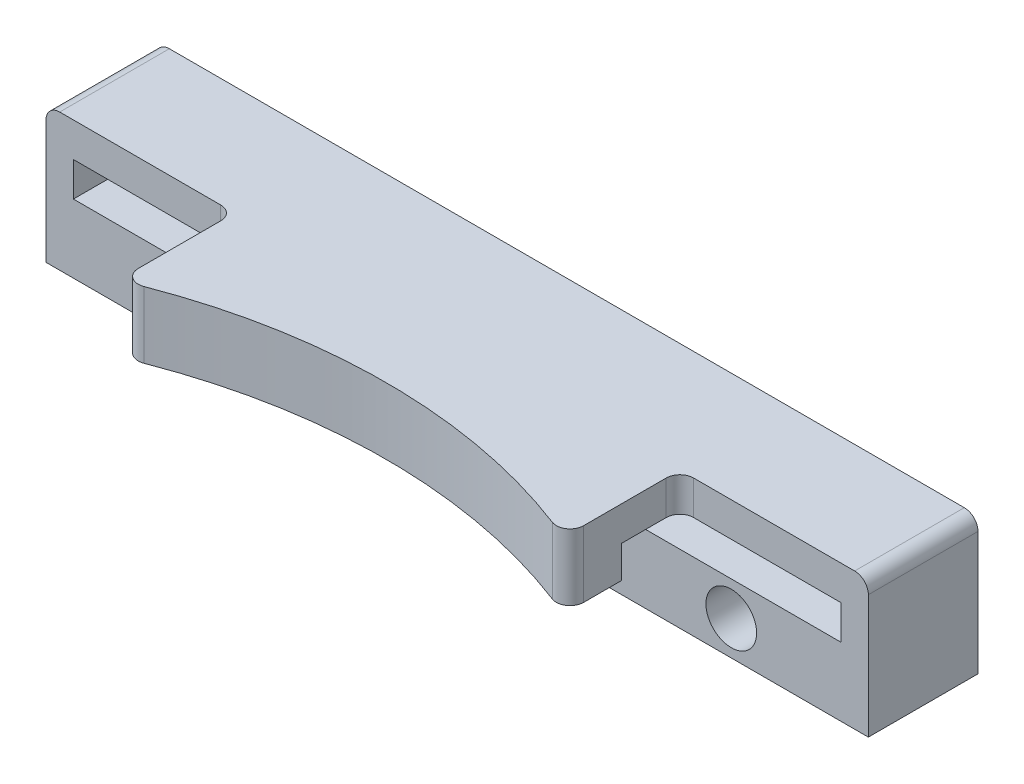
from build123d import *

# Parameters (mm, degrees)
SKETCH1_W           = 120
SKETCH1_H           = 20
SKETCH1_R           = 2
SKETCH1_W_2         = 112
SKETCH1_H_2         = 5
BOSS_EXTRUDE1_DEPTH = 16
SKETCH2_R           = 3.7
CUT_EXTRUDE1_DEPTH  = 8
BOSS_EXTRUDE2_DEPTH = 5
BOSS_EXTRUDE3_DEPTH = 4.7
FILLET1_R           = 2


with BuildPart() as part:
    # Sketch1 → Boss-Extrude1 (new body)
    with BuildSketch(Plane.XY):
        with Locations((0, 10)):
            Rectangle(SKETCH1_W, SKETCH1_H)
        with Locations((-40, 5)):
            Circle(SKETCH1_R, mode=Mode.SUBTRACT)
        with Locations((40, 5)):
            Circle(SKETCH1_R, mode=Mode.SUBTRACT)
        with Locations((0, 12.5)):
            Rectangle(SKETCH1_W_2, SKETCH1_H_2, mode=Mode.SUBTRACT)
    extrude(amount=BOSS_EXTRUDE1_DEPTH)

    # Sketch2 → Cut-Extrude1 (cut)
    with BuildSketch(Plane.XY.offset(16)):
        with Locations((-40, 5)):
            Circle(SKETCH2_R)
        with Locations((40, 5)):
            Circle(SKETCH2_R)
    extrude(amount=-CUT_EXTRUDE1_DEPTH, mode=Mode.SUBTRACT)

    # Sketch3 → Boss-Extrude2 (add)
    with BuildSketch(Plane(origin=(0, 20, 0), x_dir=(1, 0, 0), z_dir=(0, 1, 0))):
        with BuildLine():
            Line((-32.5, -33), (-32.5, -16))
            Line((-32.5, -16), (32.5, -16))
            Line((32.5, -16), (32.5, -33))
            ThreePointArc((32.5, -33), (0, -26.372442674), (-32.5, -33))
        make_face()
    extrude(amount=-BOSS_EXTRUDE2_DEPTH)

    # Sketch4 → Boss-Extrude3 (add)
    with BuildSketch(Plane.XZ.offset(-15)):
        with BuildLine():
            Line((-32.5, 24.52), (-32.5, 33))
            ThreePointArc((-32.5, 33), (0, 26.372442674), (32.5, 33))
            Line((32.5, 33), (32.5, 24.52))
            ThreePointArc((32.5, 24.52), (0, 17.892442674), (-32.5, 24.52))
        make_face()
    extrude(amount=BOSS_EXTRUDE3_DEPTH)

    # Fillet1
    fillet1_edges = [part.edges().sort_by_distance(p)[0] for p in [
        (32.5, 17.5, 16),
        (-32.5, 17.5, 16),
        (-32.5, 15.15, 33),
        (32.5, 15.15, 33),
        (-60, 20, 8),
        (60, 20, 8),
    ]]
    fillet(fillet1_edges, radius=FILLET1_R)


solid = part.part
